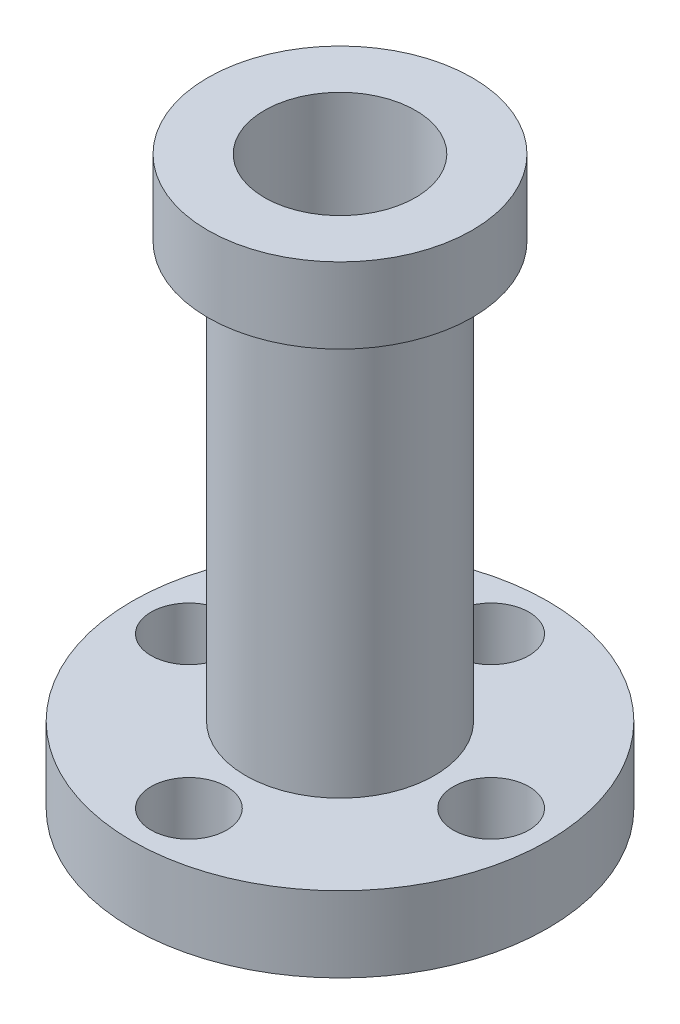
from build123d import *

# Parameters (mm, degrees)
SKETCH_2_R          = 4
CUT_EXTRUDE_1_DEPTH = 31.6
SKETCH_4_R          = 2
CUT_EXTRUDE_2_DEPTH = 31.6


with BuildPart() as part:
    # Эскиз1 → Повернуть1 (revolve)
    with BuildSketch(Plane.XY, mode=Mode.PRIVATE) as revolve_1_sk:
        Polygon((0, 0), (0, 30), (7, 30), (7, 26), (5, 26), (5, 4), (11, 4), (11, 0), align=None)
    revolve(revolve_1_sk.sketch.rotate(Axis((0, 0, 0), (0, 1, 0)), 90), axis=Axis((0, 0, 0), (0, 1, 0)))

    # Эскиз2 → Вырез-Вытянуть1 (cut)
    with BuildSketch(Plane(origin=(0, 30, 0), x_dir=(1, 0, 0), z_dir=(0, 1, 0))):
        with Locations(Location((0, 0, 0), (0, 0, 270))):
            Circle(SKETCH_2_R)
    extrude(amount=-CUT_EXTRUDE_1_DEPTH, mode=Mode.SUBTRACT)

    # Эскиз4 → Вырез-Вытянуть2 (cut)
    with BuildSketch(Plane(origin=(0, 4, 0), x_dir=(1, 0, 0), z_dir=(0, 1, 0))):
        with Locations(Location((8, 0, 0), (0, 0, 270))):
            Circle(SKETCH_4_R)
        with Locations(Location((0, 8, 0), (0, 0, 270))):
            Circle(SKETCH_4_R)
        with Locations(Location((-8, 0, 0), (0, 0, 270))):
            Circle(SKETCH_4_R)
        with Locations(Location((0, -8, 0), (0, 0, 270))):
            Circle(SKETCH_4_R)
    extrude(amount=-CUT_EXTRUDE_2_DEPTH, mode=Mode.SUBTRACT)


solid = part.part
